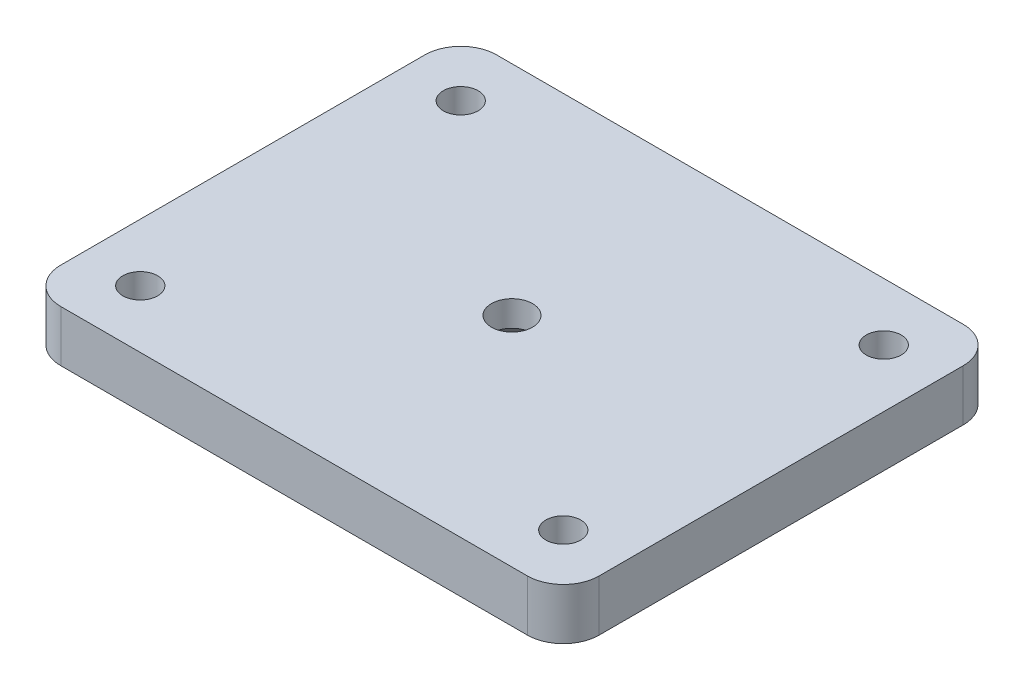
from build123d import *

# Parameters (mm, degrees)
SKETCH2_W                                  = 105
SKETCH2_H                                  = 85
BOSS_EXTRUDE1_DEPTH                        = 10
CASTER_MOUNTING_HOLES_TZPPED_HOLES_M8X1_D  = 6.8
CENTER_PROFILE_CS_HOLE_M8X1_25_D           = 8
CENTER_PROFILE_CS_HOLE_M8X1_25_DEPTH       = 10
CENTER_PROFILE_CS_HOLE_M8X1_25_CSINK_D     = 18
CENTER_PROFILE_CS_HOLE_M8X1_25_CSINK_ANGLE = 90
CENTER_PROFILE_CS_HOLE_M8X1_25_TIP         = 2.403442476
FILLET1_R                                  = 7


with BuildPart() as part:
    # Sketch2 → Boss-Extrude1 (new body)
    with BuildSketch(Plane(origin=(0, 0, 0), x_dir=(1, 0, 0), z_dir=(0, 1, 0))):
        Rectangle(SKETCH2_W, SKETCH2_H)
    extrude(amount=BOSS_EXTRUDE1_DEPTH)

    # caster mounting holes tzpped holes, m8x1.25 (through all)
    with Locations(Plane(origin=(0, 10, 0), x_dir=(1, 0, 0), z_dir=(0, 1, 0))):
        with Locations((-41.25, 31.25), (-41.25, -31.25), (41.25, -31.25), (41.25, 31.25)):
            Hole(CASTER_MOUNTING_HOLES_TZPPED_HOLES_M8X1_D / 2)

    # center profile cs hole, m8x1.25
    with Locations(Plane(origin=(0, 0, 0), x_dir=(-1, 0, 0), z_dir=(0, -1, 0))):
        with Locations((0, 0)):
            CounterSinkHole(CENTER_PROFILE_CS_HOLE_M8X1_25_D / 2, CENTER_PROFILE_CS_HOLE_M8X1_25_CSINK_D / 2, depth=CENTER_PROFILE_CS_HOLE_M8X1_25_DEPTH, counter_sink_angle=CENTER_PROFILE_CS_HOLE_M8X1_25_CSINK_ANGLE)
            with Locations((0, 0, -(CENTER_PROFILE_CS_HOLE_M8X1_25_DEPTH + CENTER_PROFILE_CS_HOLE_M8X1_25_TIP / 2))):  # 118° drill point
                Cone(0, CENTER_PROFILE_CS_HOLE_M8X1_25_D / 2, CENTER_PROFILE_CS_HOLE_M8X1_25_TIP, mode=Mode.SUBTRACT)

    # Fillet1
    fillet1_edges = [part.edges().sort_by_distance(p)[0] for p in [
        (52.5, 5, 42.5),
        (-52.5, 5, 42.5),
        (-52.5, 5, -42.5),
        (52.5, 5, -42.5),
    ]]
    fillet(fillet1_edges, radius=FILLET1_R)


solid = part.part
